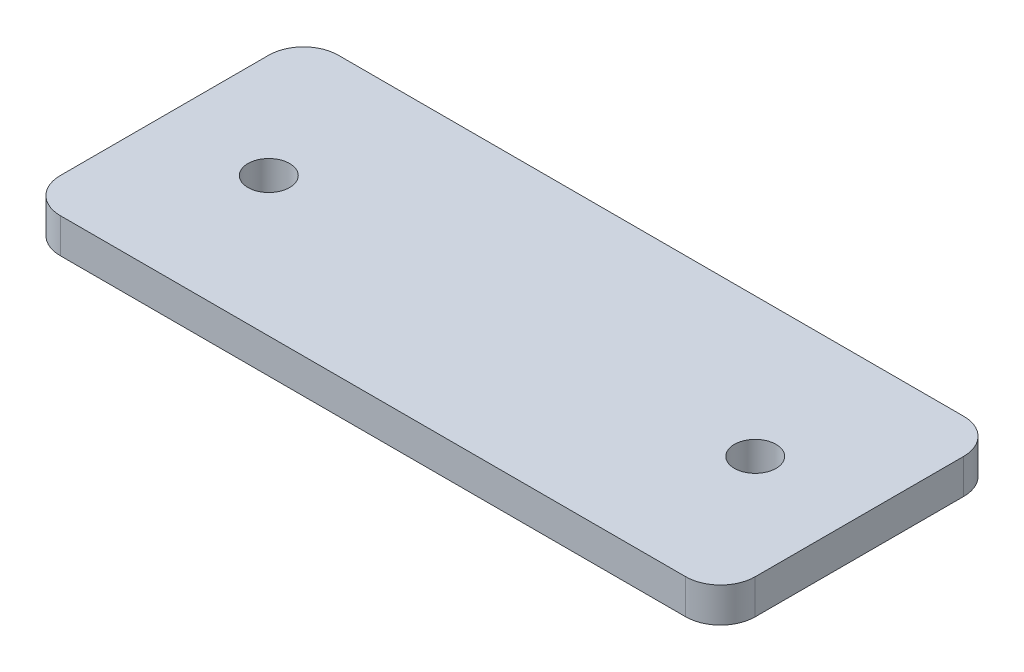
from build123d import *

# Parameters (mm, degrees)
ESBO_O1_W                = 100
ESBO_O1_H                = 40
RESSALTO_EXTRUS_O1_DEPTH = 5
FILETE1_R                = 5
ESBO_O2_R                = 3
CORTE_EXTRUS_O1_DEPTH    = 5


with BuildPart() as part:
    # Esboço1 → Ressalto-extrusão1 (new body)
    with BuildSketch(Plane(origin=(0, 0, 0), x_dir=(1, 0, 0), z_dir=(0, 1, 0))):
        Rectangle(ESBO_O1_W, ESBO_O1_H)
    extrude(amount=RESSALTO_EXTRUS_O1_DEPTH)

    # Filete1
    filete1_edges = [part.edges().sort_by_distance(p)[0] for p in [
        (-50, 2.5, -20),
        (50, 2.5, -20),
        (50, 2.5, 20),
        (-50, 2.5, 20),
    ]]
    fillet(filete1_edges, radius=FILETE1_R)

    # Esboço2 → Corte-extrusão1 (cut)
    with BuildSketch(Plane(origin=(0, 5, 0), x_dir=(1, 0, 0), z_dir=(0, 1, 0))):
        with Locations(Location((-35, 0, 0), (0, 0, 270))):
            Circle(ESBO_O2_R)
        with Locations(Location((35, 0, 0), (0, 0, 270))):
            Circle(ESBO_O2_R)
    extrude(amount=-CORTE_EXTRUS_O1_DEPTH, mode=Mode.SUBTRACT)


solid = part.part
